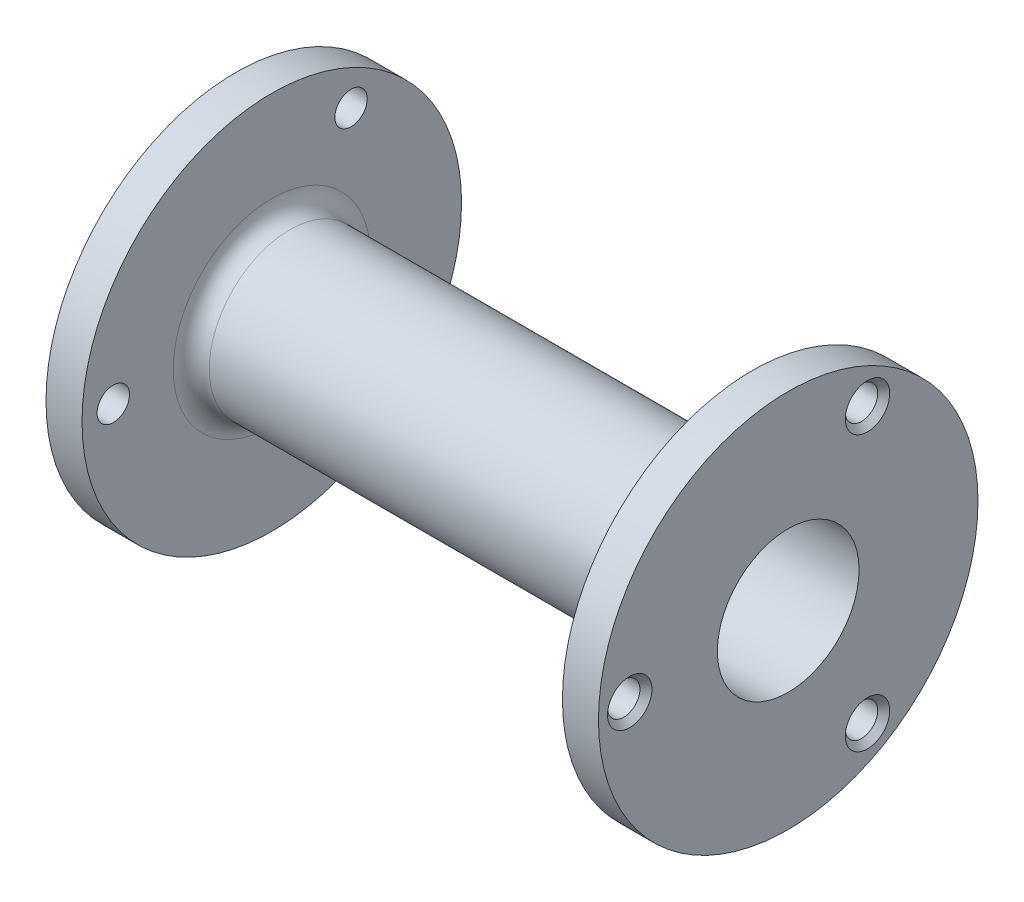
from build123d import *

# Parameters (mm, degrees)
SKETCH3_R          = 1.35
CUT_EXTRUDE1_DEPTH = 52.139808369
CHAMFER1_SIZE      = 0.5


with BuildPart() as part:
    # Sketch1 → Revolve1 (revolve)
    with BuildSketch(Plane.XY, mode=Mode.PRIVATE) as revolve1_sk:
        with BuildLine():
            Line((0, 5.9), (0, 15.8))
            Line((0, 15.8), (3, 15.8))
            Line((3, 15.8), (3, 8.21))
            ThreePointArc((3, 8.21), (3.439339828, 7.149339828), (4.5, 6.71))
            Line((4.5, 6.71), (41.5, 6.71))
            ThreePointArc((41.5, 6.71), (42.560660172, 7.149339828), (43, 8.21))
            Line((43, 8.21), (43, 15.8))
            Line((43, 15.8), (46, 15.8))
            Line((46, 15.8), (46, 5.9))
            Line((46, 5.9), (43, 5.9))
            Line((43, 5.9), (3, 5.9))
            Line((3, 5.9), (0, 5.9))
        make_face()
    revolve(revolve1_sk.sketch.rotate(Axis((0, 0, 0), (-1, 0, 0)), 90), axis=Axis((0, 0, 0), (-1, 0, 0)))

    # Sketch3 → Cut-Extrude1 (cut, through all)
    with BuildSketch(Plane(origin=(46, 0, 0), x_dir=(0, 0, -1), z_dir=(1, 0, 0))):
        with Locations((-13.2, 0)):
            Circle(SKETCH3_R)
        with Locations((6.6, 11.43153533)):
            Circle(SKETCH3_R)
        with Locations((6.6, -11.43153533)):
            Circle(SKETCH3_R)
    extrude(amount=-CUT_EXTRUDE1_DEPTH, mode=Mode.SUBTRACT)

    # Chamfer1
    chamfer1_edges = [part.edges().sort_by_distance(p)[0] for p in [
        (0, 0, 14.55),
        (46, 0, 14.55),
        (0, 11.43153533, -5.25),
        (46, 11.43153533, -5.25),
        (0, -11.43153533, -5.25),
        (46, -11.43153533, -5.25),
    ]]
    chamfer(chamfer1_edges, length=CHAMFER1_SIZE)


solid = part.part
